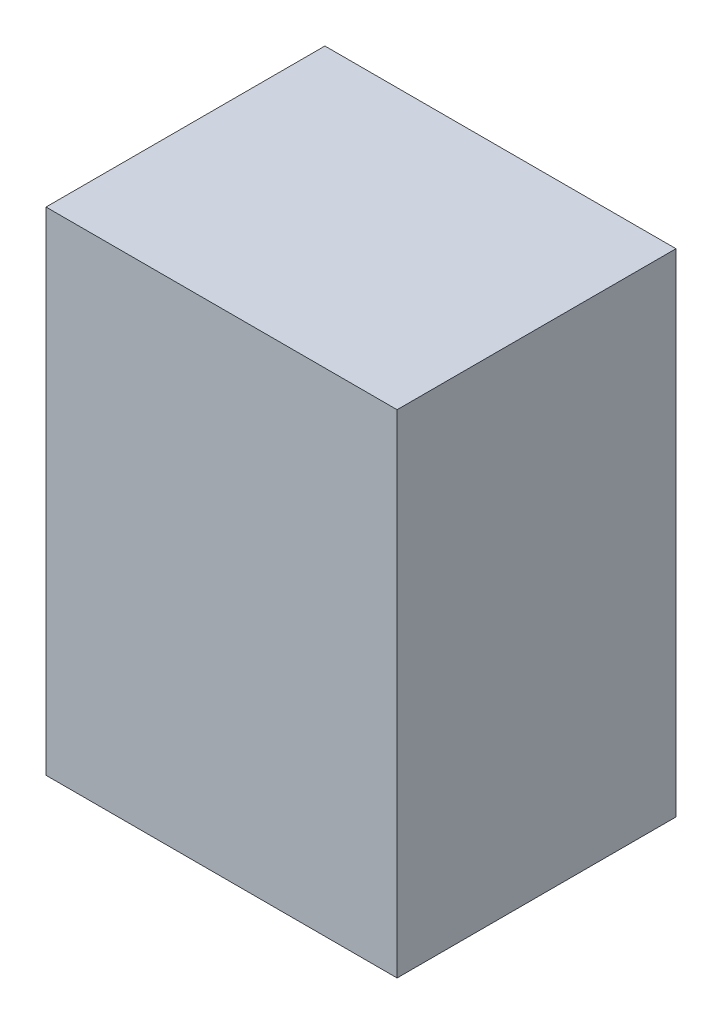
from build123d import *

# Parameters (mm, degrees)
SKETCH1_W           = 107
SKETCH1_H           = 150
BOSS_EXTRUDE1_DEPTH = 85


with BuildPart() as part:
    # Sketch1 → Boss-Extrude1 (new body)
    with BuildSketch(Plane.XY):
        with Locations((53.5, 75)):
            Rectangle(SKETCH1_W, SKETCH1_H)
    extrude(amount=BOSS_EXTRUDE1_DEPTH)


solid = part.part
